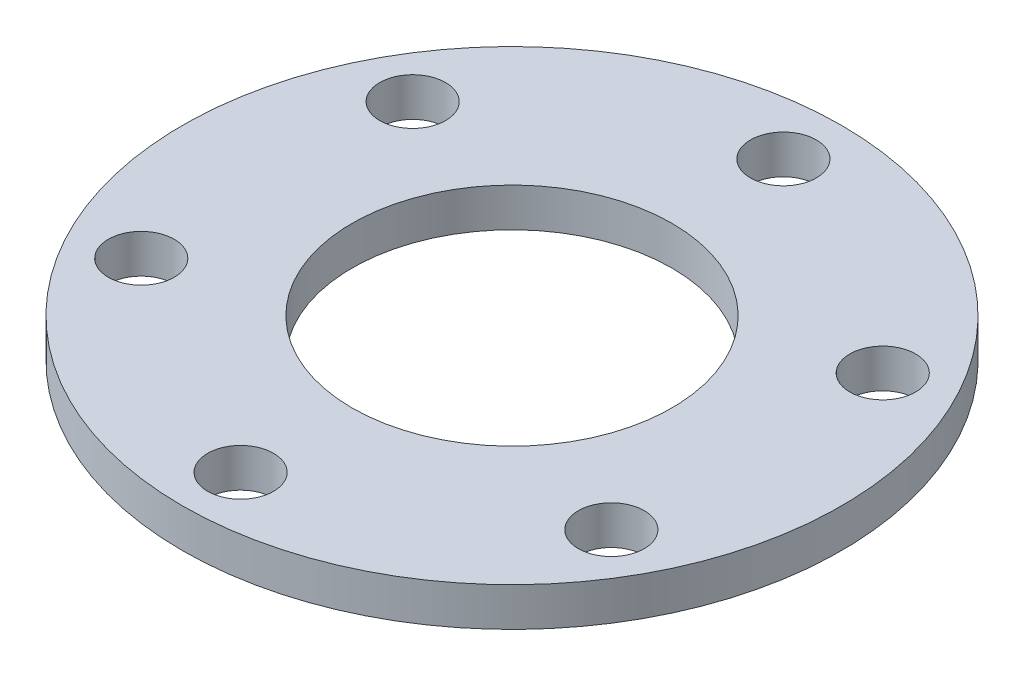
from build123d import *

# Parameters (mm, degrees)
SKETCH1_R           = 17
SKETCH1_R_2         = 8.25
SKETCH1_R_3         = 1.7
BOSS_EXTRUDE1_DEPTH = 2


with BuildPart() as part:
    # Sketch1 → Boss-Extrude1 (new body)
    with BuildSketch(Plane(origin=(0, 0, 0), x_dir=(1, 0, 0), z_dir=(0, 1, 0))):
        with Locations(Location((0, 0, 0), (0, 0, 270))):
            Circle(SKETCH1_R)
        with Locations(Location((0, 0, 0), (0, 0, 270))):
            Circle(SKETCH1_R_2, mode=Mode.SUBTRACT)
        with Locations(Location((0, 14, 0), (0, 0, 270))):
            Circle(SKETCH1_R_3, mode=Mode.SUBTRACT)
        with Locations(Location((12.124355653, 7, 0), (0, 0, 270))):
            Circle(SKETCH1_R_3, mode=Mode.SUBTRACT)
        with Locations(Location((12.124355653, -7, 0), (0, 0, 270))):
            Circle(SKETCH1_R_3, mode=Mode.SUBTRACT)
        with Locations(Location((0, -14, 0), (0, 0, 270))):
            Circle(SKETCH1_R_3, mode=Mode.SUBTRACT)
        with Locations(Location((-12.124355653, -7, 0), (0, 0, 270))):
            Circle(SKETCH1_R_3, mode=Mode.SUBTRACT)
        with Locations(Location((-12.124355653, 7, 0), (0, 0, 270))):
            Circle(SKETCH1_R_3, mode=Mode.SUBTRACT)
    extrude(amount=BOSS_EXTRUDE1_DEPTH)


solid = part.part
